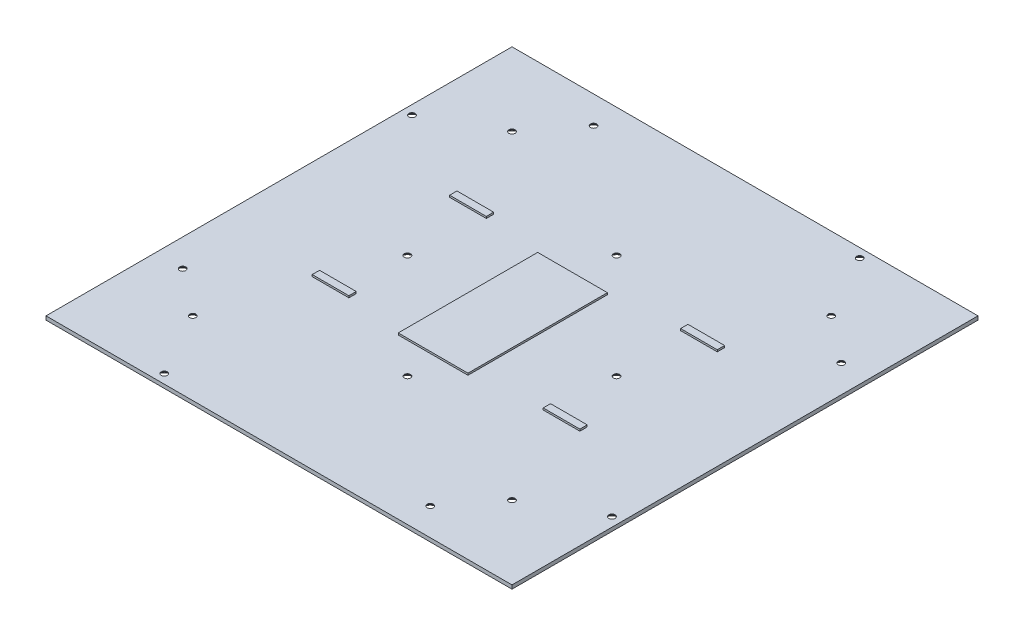
from build123d import *

# Parameters (mm, degrees)
SKETCH1_W                                      = 254
SKETCH1_H                                      = 254
BOSS_EXTRUDE1_DEPTH                            = 1.016
CSK_FOR_M3_FLAT_HEAD_MACHINE_SCREW2_AT_2_COUNT = 2
CSK_FOR_M3_FLAT_HEAD_MACHINE_SCREW2_AT_2_PITCH = 70.359789653
CSK_FOR_M3_FLAT_HEAD_MACHINE_SCREW2_AT_3_COUNT = 2
CSK_FOR_M3_FLAT_HEAD_MACHINE_SCREW2_AT_3_PITCH = 184.933771929
CSK_FOR_M3_FLAT_HEAD_MACHINE_SCREW2_AT_4_COUNT = 2
CSK_FOR_M3_FLAT_HEAD_MACHINE_SCREW2_AT_4_PITCH = 234
CSK_FOR_M3_FLAT_HEAD_MACHINE_SCREW2_AT_5_COUNT = 2
CSK_FOR_M3_FLAT_HEAD_MACHINE_SCREW2_AT_5_PITCH = 261.535848403
CSK_FOR_M3_FLAT_HEAD_MACHINE_SCREW2_AT_6_COUNT = 2
CSK_FOR_M3_FLAT_HEAD_MACHINE_SCREW2_AT_6_PITCH = 184.933771929
CSK_FOR_M3_FLAT_HEAD_MACHINE_SCREW2_AT_7_COUNT = 2
CSK_FOR_M3_FLAT_HEAD_MACHINE_SCREW2_AT_7_PITCH = 135.369863707
CSK_FOR_M3_FLAT_HEAD_MACHINE_SCREW2_AT_8_COUNT = 2
CSK_FOR_M3_FLAT_HEAD_MACHINE_SCREW2_AT_8_PITCH = 261.018198599
SKETCH10_W                                     = 20
SKETCH10_H                                     = 4
SKETCH10_W_2                                   = 38
SKETCH10_H_2                                   = 76
BOSS_EXTRUDE2_DEPTH                            = 1
CSK_FOR_M3_FLAT_HEAD_MACHINE_SCREW3_AT_2_COUNT = 2
CSK_FOR_M3_FLAT_HEAD_MACHINE_SCREW3_AT_2_PITCH = 80.610173055
CSK_FOR_M3_FLAT_HEAD_MACHINE_SCREW3_AT_3_COUNT = 2
CSK_FOR_M3_FLAT_HEAD_MACHINE_SCREW3_AT_3_PITCH = 80.610173055
CSK_FOR_M3_FLAT_HEAD_MACHINE_SCREW3_AT_4_COUNT = 2
CSK_FOR_M3_FLAT_HEAD_MACHINE_SCREW3_AT_4_PITCH = 114
CSK_FOR_M3_FLAT_HEAD_MACHINE_SCREW3_AT_5_COUNT = 2
CSK_FOR_M3_FLAT_HEAD_MACHINE_SCREW3_AT_5_PITCH = 168.240898714
CSK_FOR_M3_FLAT_HEAD_MACHINE_SCREW3_AT_6_COUNT = 2
CSK_FOR_M3_FLAT_HEAD_MACHINE_SCREW3_AT_6_PITCH = 92.027169901
CSK_FOR_M3_FLAT_HEAD_MACHINE_SCREW3_AT_7_COUNT = 2
CSK_FOR_M3_FLAT_HEAD_MACHINE_SCREW3_AT_7_PITCH = 92.027169901
CSK_FOR_M3_FLAT_HEAD_MACHINE_SCREW3_AT_8_COUNT = 2
CSK_FOR_M3_FLAT_HEAD_MACHINE_SCREW3_AT_8_PITCH = 168.240898714


with BuildPart() as part:
    # Sketch1 → Boss-Extrude1 (new, symmetric)
    with BuildSketch(Plane(origin=(0, 0, 0), x_dir=(1, 0, 0), z_dir=(0, 1, 0))):
        Rectangle(SKETCH1_W, SKETCH1_H)
    extrude(amount=BOSS_EXTRUDE1_DEPTH, both=True)

    # Sketch9 → CSK for M3 Flat Head Machine Screw2 (revolve, cut)
    with BuildSketch(Plane(origin=(-67.5, -1.016, -112), x_dir=(0, 0, -1), z_dir=(1, 0, 0))):
        Polygon((0, 0), (0, 2.032), (1.7, 2.032), (1.7, 1.7), (3.4, 0), align=None)
    csk_for_m3_flat_head_machine_screw2 = revolve(axis=Axis((-67.5, -7.366, -112), (0, 1, 0)), mode=Mode.SUBTRACT)

    # CSK for M3 Flat Head Machine Screw2 at 2: CSK for M3 Flat Head Machine Screw2 ×2
    with Locations(*[Vector(-0.7745901496986006, 0, 0.6324635167263798) * (i * CSK_FOR_M3_FLAT_HEAD_MACHINE_SCREW2_AT_2_PITCH) for i in range(1, CSK_FOR_M3_FLAT_HEAD_MACHINE_SCREW2_AT_2_COUNT)]):
        add(csk_for_m3_flat_head_machine_screw2, mode=Mode.SUBTRACT)

    # CSK for M3 Flat Head Machine Screw2 at 3: CSK for M3 Flat Head Machine Screw2 ×2
    with Locations(*[Vector(-0.24062668238341703, 0, 0.9706177412994006) * (i * CSK_FOR_M3_FLAT_HEAD_MACHINE_SCREW2_AT_3_PITCH) for i in range(1, CSK_FOR_M3_FLAT_HEAD_MACHINE_SCREW2_AT_3_COUNT)]):
        add(csk_for_m3_flat_head_machine_screw2, mode=Mode.SUBTRACT)

    # CSK for M3 Flat Head Machine Screw2 at 4: CSK for M3 Flat Head Machine Screw2 ×2
    with Locations(*[(0, 0, i * CSK_FOR_M3_FLAT_HEAD_MACHINE_SCREW2_AT_4_PITCH) for i in range(1, CSK_FOR_M3_FLAT_HEAD_MACHINE_SCREW2_AT_4_COUNT)]):
        add(csk_for_m3_flat_head_machine_screw2, mode=Mode.SUBTRACT)

    # CSK for M3 Flat Head Machine Screw2 at 5: CSK for M3 Flat Head Machine Screw2 ×2
    with Locations(*[Vector(0.5161816279650405, 0, 0.856479145660512) * (i * CSK_FOR_M3_FLAT_HEAD_MACHINE_SCREW2_AT_5_PITCH) for i in range(1, CSK_FOR_M3_FLAT_HEAD_MACHINE_SCREW2_AT_5_COUNT)]):
        add(csk_for_m3_flat_head_machine_screw2, mode=Mode.SUBTRACT)

    # CSK for M3 Flat Head Machine Screw2 at 6: CSK for M3 Flat Head Machine Screw2 ×2
    with Locations(*[Vector(0.9706177412994007, 0, 0.2406266823834169) * (i * CSK_FOR_M3_FLAT_HEAD_MACHINE_SCREW2_AT_6_PITCH) for i in range(1, CSK_FOR_M3_FLAT_HEAD_MACHINE_SCREW2_AT_6_COUNT)]):
        add(csk_for_m3_flat_head_machine_screw2, mode=Mode.SUBTRACT)

    # CSK for M3 Flat Head Machine Screw2 at 7: CSK for M3 Flat Head Machine Screw2 ×2
    with Locations(*[Vector(0.997267754456709, 0, -0.07387168551531198) * (i * CSK_FOR_M3_FLAT_HEAD_MACHINE_SCREW2_AT_7_PITCH) for i in range(1, CSK_FOR_M3_FLAT_HEAD_MACHINE_SCREW2_AT_7_COUNT)]):
        add(csk_for_m3_flat_head_machine_screw2, mode=Mode.SUBTRACT)

    # CSK for M3 Flat Head Machine Screw2 at 8: CSK for M3 Flat Head Machine Screw2 ×2
    with Locations(*[Vector(0.7260030182452614, 0, 0.687691513324667) * (i * CSK_FOR_M3_FLAT_HEAD_MACHINE_SCREW2_AT_8_PITCH) for i in range(1, CSK_FOR_M3_FLAT_HEAD_MACHINE_SCREW2_AT_8_COUNT)]):
        add(csk_for_m3_flat_head_machine_screw2, mode=Mode.SUBTRACT)

    # Sketch10 → Boss-Extrude2 (add)
    with BuildSketch(Plane(origin=(0, 1.016, 0), x_dir=(1, 0, 0), z_dir=(0, 1, 0))):
        with Locations((-62.95, 40.95)):
            Rectangle(SKETCH10_W, SKETCH10_H)
        with Locations((62.95, 40.95)):
            Rectangle(SKETCH10_W, SKETCH10_H)
        with Locations((-62.95, -33.95)):
            Rectangle(SKETCH10_W, SKETCH10_H)
        with Locations((62.95, -33.95)):
            Rectangle(SKETCH10_W, SKETCH10_H)
        with Locations((-2.95, -2.05)):
            Rectangle(SKETCH10_W_2, SKETCH10_H_2)
    extrude(amount=BOSS_EXTRUDE2_DEPTH)

    # Sketch13 → CSK for M3 Flat Head Machine Screw3 (revolve, cut)
    with BuildSketch(Plane(origin=(0, -1.016, 57), x_dir=(0, 0, -1), z_dir=(1, 0, 0))):
        Polygon((0, 0), (0, 3.032), (1.7, 3.032), (1.7, 1.7), (3.4, 0), align=None)
    csk_for_m3_flat_head_machine_screw3 = revolve(axis=Axis((0, -7.366, 57), (0, 1, 0)), mode=Mode.SUBTRACT)

    # CSK for M3 Flat Head Machine Screw3 at 2: CSK for M3 Flat Head Machine Screw3 ×2
    with Locations(*[Vector(0.7071067811865476, 0, -0.7071067811865476) * (i * CSK_FOR_M3_FLAT_HEAD_MACHINE_SCREW3_AT_2_PITCH) for i in range(1, CSK_FOR_M3_FLAT_HEAD_MACHINE_SCREW3_AT_2_COUNT)]):
        add(csk_for_m3_flat_head_machine_screw3, mode=Mode.SUBTRACT)

    # CSK for M3 Flat Head Machine Screw3 at 3: CSK for M3 Flat Head Machine Screw3 ×2
    with Locations(*[Vector(-0.7071067811865476, 0, -0.7071067811865476) * (i * CSK_FOR_M3_FLAT_HEAD_MACHINE_SCREW3_AT_3_PITCH) for i in range(1, CSK_FOR_M3_FLAT_HEAD_MACHINE_SCREW3_AT_3_COUNT)]):
        add(csk_for_m3_flat_head_machine_screw3, mode=Mode.SUBTRACT)

    # CSK for M3 Flat Head Machine Screw3 at 4: CSK for M3 Flat Head Machine Screw3 ×2
    with Locations(*[(0, 0, -i * CSK_FOR_M3_FLAT_HEAD_MACHINE_SCREW3_AT_4_PITCH) for i in range(1, CSK_FOR_M3_FLAT_HEAD_MACHINE_SCREW3_AT_4_COUNT)]):
        add(csk_for_m3_flat_head_machine_screw3, mode=Mode.SUBTRACT)

    # CSK for M3 Flat Head Machine Screw3 at 5: CSK for M3 Flat Head Machine Screw3 ×2
    with Locations(*[Vector(-0.5171156399255817, 0, -0.8559155419457904) * (i * CSK_FOR_M3_FLAT_HEAD_MACHINE_SCREW3_AT_5_PITCH) for i in range(1, CSK_FOR_M3_FLAT_HEAD_MACHINE_SCREW3_AT_5_COUNT)]):
        add(csk_for_m3_flat_head_machine_screw3, mode=Mode.SUBTRACT)

    # CSK for M3 Flat Head Machine Screw3 at 6: CSK for M3 Flat Head Machine Screw3 ×2
    with Locations(*[Vector(-0.9453729816262721, 0, 0.32599068331940434) * (i * CSK_FOR_M3_FLAT_HEAD_MACHINE_SCREW3_AT_6_PITCH) for i in range(1, CSK_FOR_M3_FLAT_HEAD_MACHINE_SCREW3_AT_6_COUNT)]):
        add(csk_for_m3_flat_head_machine_screw3, mode=Mode.SUBTRACT)

    # CSK for M3 Flat Head Machine Screw3 at 7: CSK for M3 Flat Head Machine Screw3 ×2
    with Locations(*[Vector(0.9453729816262721, 0, 0.32599068331940434) * (i * CSK_FOR_M3_FLAT_HEAD_MACHINE_SCREW3_AT_7_PITCH) for i in range(1, CSK_FOR_M3_FLAT_HEAD_MACHINE_SCREW3_AT_7_COUNT)]):
        add(csk_for_m3_flat_head_machine_screw3, mode=Mode.SUBTRACT)

    # CSK for M3 Flat Head Machine Screw3 at 8: CSK for M3 Flat Head Machine Screw3 ×2
    with Locations(*[Vector(0.5171156399255817, 0, -0.8559155419457904) * (i * CSK_FOR_M3_FLAT_HEAD_MACHINE_SCREW3_AT_8_PITCH) for i in range(1, CSK_FOR_M3_FLAT_HEAD_MACHINE_SCREW3_AT_8_COUNT)]):
        add(csk_for_m3_flat_head_machine_screw3, mode=Mode.SUBTRACT)


solid = part.part
